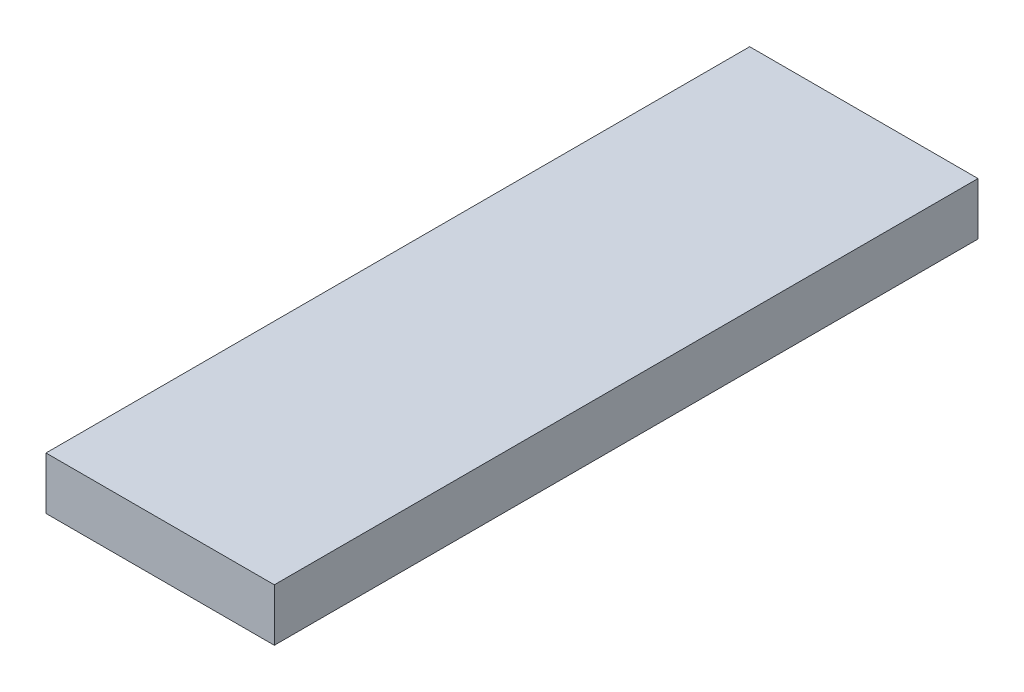
from build123d import *

# Parameters (mm, degrees)
SKETCH1_W           = 387.35
SKETCH1_H           = 1193.8
BOSS_EXTRUDE1_DEPTH = 88.9


with BuildPart() as part:
    # Sketch1 → Boss-Extrude1 (new body)
    with BuildSketch(Plane(origin=(0, 0, 0), x_dir=(1, 0, 0), z_dir=(0, 1, 0))):
        Rectangle(SKETCH1_W, SKETCH1_H)
    extrude(amount=BOSS_EXTRUDE1_DEPTH)


solid = part.part
